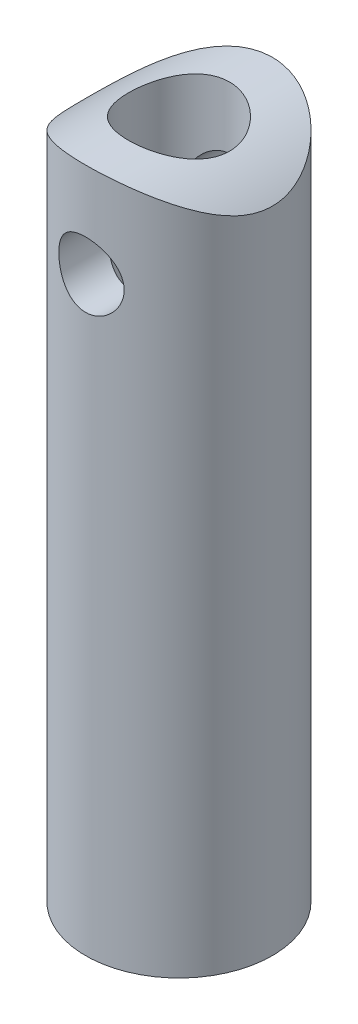
from build123d import *

# Parameters (mm, degrees)
CUT_EXTRUDE1_DEPTH      = 10
CUT_EXTRUDE1_DEPTH_BACK = 10
SKETCH2_R               = 2.1


with BuildPart() as part:
    # Sketch1 → Revolve1 (revolve)
    with BuildSketch(Plane.XY):
        Polygon((2.15, 0), (6, 0), (6, 44), (3.25, 44), (3.25, 10), (2.15, 10), align=None)
    revolve(axis=Axis((0, 0, 0), (0, 1, 0)))

    # Sketch2 → Cut-Extrude1 (cut, two sides: drawn at the far end of the back side and taken through both)
    with BuildSketch(Plane.XY.offset(-CUT_EXTRUDE1_DEPTH_BACK)):
        with BuildLine():
            Line((6, 44), (0, 44))
            ThreePointArc((0, 44), (3.211398808, 43.407551231), (6, 41.708203932))
            Line((6, 41.708203932), (6, 44))
        make_face()
        with BuildLine():
            Line((-6, 44), (-6, 41.708203932))
            ThreePointArc((-6, 41.708203932), (-3.211398808, 43.407551231), (0, 44))
            Line((0, 44), (-6, 44))
        make_face()
        with Locations((0, 37.9)):
            Circle(SKETCH2_R)
    extrude(amount=CUT_EXTRUDE1_DEPTH + CUT_EXTRUDE1_DEPTH_BACK, mode=Mode.SUBTRACT)


solid = part.part
